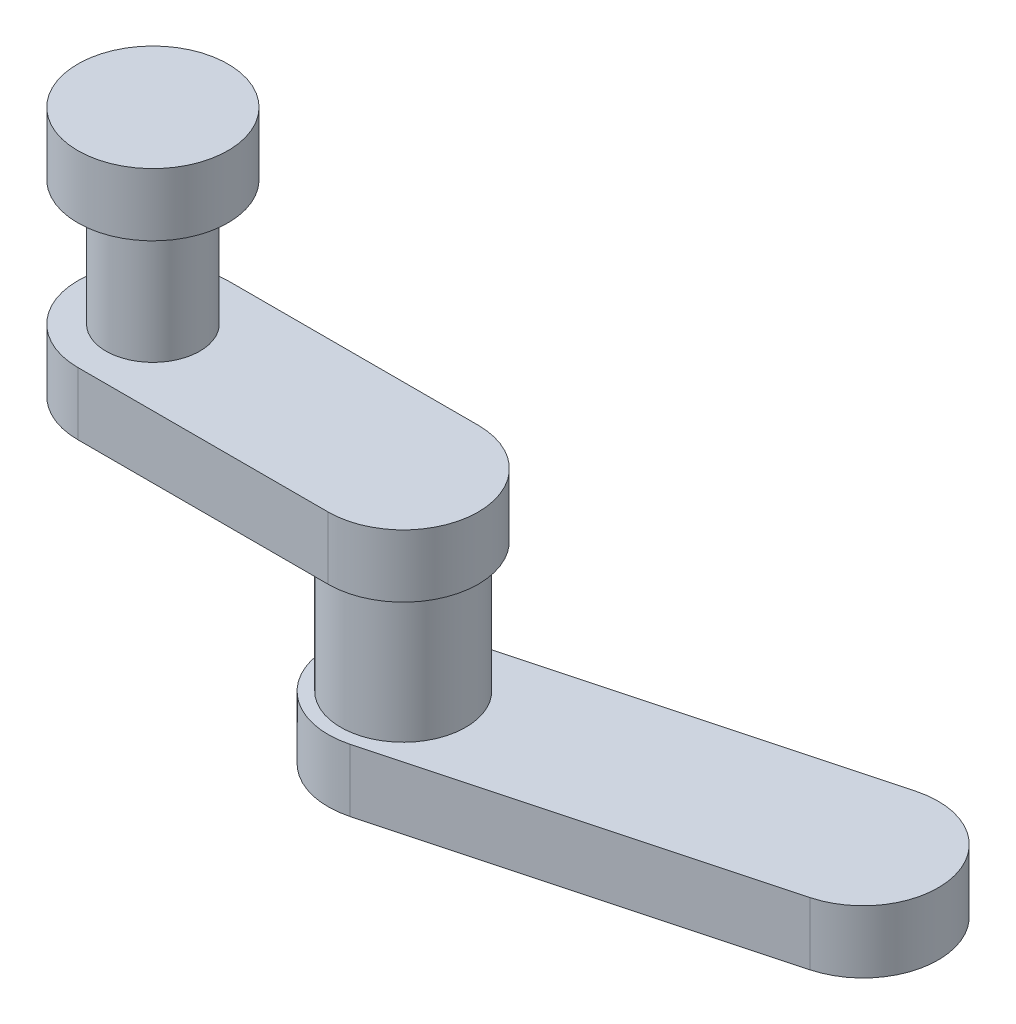
from build123d import *

# Parameters (mm, degrees)
SKETCH1_R           = 3.175
BOSS_EXTRUDE1_DEPTH = 6.604
SKETCH2_R           = 2.38125
BOSS_EXTRUDE2_DEPTH = 3.175
SKETCH2_3_R         = 2.38125
BOSS_EXTRUDE3_DEPTH = 9.525
SKETCH4_R           = 3.81
BOSS_EXTRUDE4_DEPTH = 3.175
BOSS_EXTRUDE5_START = 3.175
BOSS_EXTRUDE5_DEPTH = 3.175


with BuildPart() as part:
    # Sketch1 → Boss-Extrude1 (new body)
    with BuildSketch(Plane(origin=(0, 0, 0), x_dir=(1, 0, 0), z_dir=(0, 1, 0))):
        Circle(SKETCH1_R)
    extrude(amount=BOSS_EXTRUDE1_DEPTH)

    # Sketch2 → Boss-Extrude2 (add)
    with BuildSketch(Plane(origin=(0, 6.604, 0), x_dir=(1, 0, 0), z_dir=(0, 1, 0))):
        with BuildLine():
            Line((0, -3.81), (-12.7, -3.81))
            ThreePointArc((-12.7, -3.81), (-16.51, 0), (-12.7, 3.81))
            Line((-12.7, 3.81), (0, 3.81))
            ThreePointArc((0, 3.81), (3.81, 0), (0, -3.81))
        make_face()
        with Locations((-12.7, 0)):
            Circle(SKETCH2_R, mode=Mode.SUBTRACT)
    extrude(amount=BOSS_EXTRUDE2_DEPTH)

    # Sketch2<3> → Boss-Extrude3 (add)
    with BuildSketch(Plane(origin=(0, 6.604, 0), x_dir=(1, 0, 0), z_dir=(0, 1, 0))):
        with Locations((-12.7, 0)):
            Circle(SKETCH2_3_R)
    extrude(amount=BOSS_EXTRUDE3_DEPTH)

    # Sketch4 → Boss-Extrude4 (add)
    with BuildSketch(Plane(origin=(0, 16.129, 0), x_dir=(1, 0, 0), z_dir=(0, 1, 0))):
        with Locations((-12.7, 0)):
            Circle(SKETCH4_R)
    extrude(amount=BOSS_EXTRUDE4_DEPTH)

    # Sketch5 → Boss-Extrude5 (add)
    with BuildSketch(Plane.XZ.offset(BOSS_EXTRUDE5_START)):
        with BuildLine():
            Line((0.986100562, 3.680177398), (19.386987553, -1.250325411))
            ThreePointArc((19.386987553, -1.250325411), (22.081064389, -5.916603371), (17.414786429, -8.610680207))
            Line((17.414786429, -8.610680207), (-0.986100562, -3.680177398))
            ThreePointArc((-0.986100562, -3.680177398), (-3.680177398, 0.986100562), (0.986100562, 3.680177398))
        make_face()
    extrude(amount=-BOSS_EXTRUDE5_DEPTH)


solid = part.part
